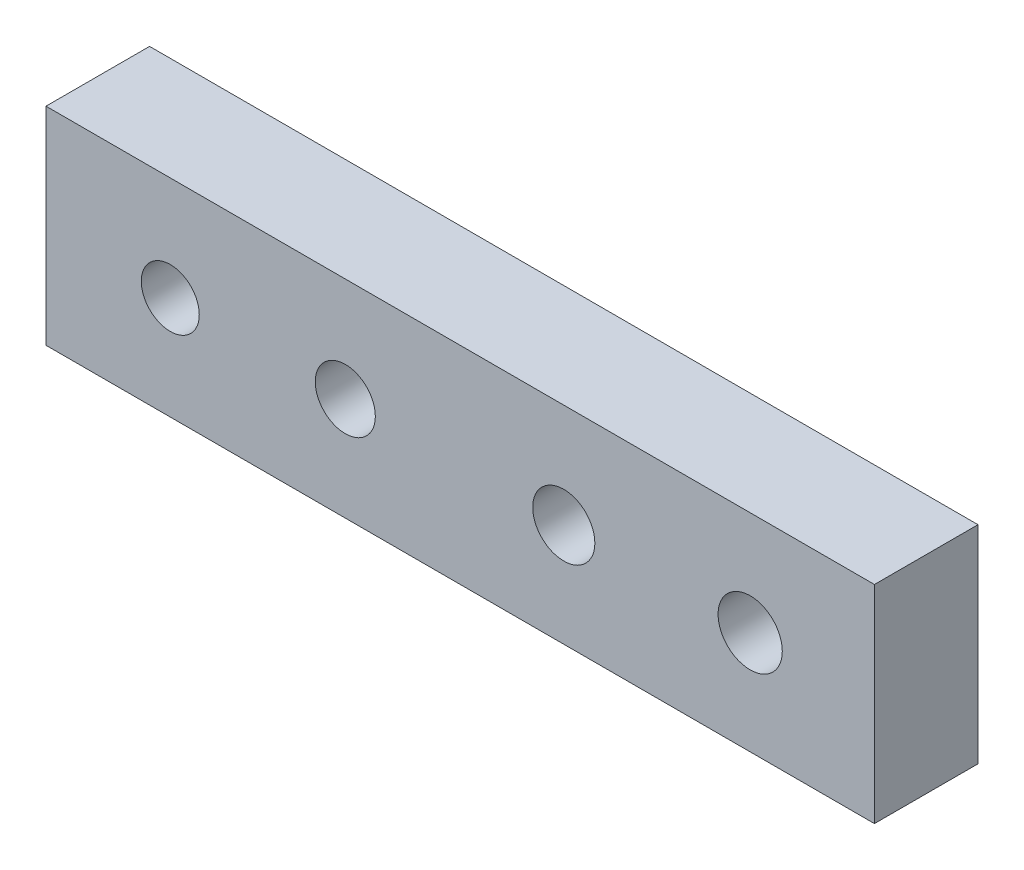
from build123d import *

# Parameters (mm, degrees)
SKETCH2_W           = 40
SKETCH2_H           = 10
BOSS_EXTRUDE1_DEPTH = 5
SKETCH3_R           = 1.4
SKETCH3_R_2         = 1.45
SKETCH3_R_3         = 1.5
SKETCH3_R_4         = 1.55
CUT_EXTRUDE1_DEPTH  = 5


with BuildPart() as part:
    # Sketch2 → Boss-Extrude1 (new body)
    with BuildSketch(Plane.XY):
        with Locations((20, -5)):
            Rectangle(SKETCH2_W, SKETCH2_H)
    extrude(amount=BOSS_EXTRUDE1_DEPTH)

    # Sketch3 → Cut-Extrude1 (cut)
    with BuildSketch(Plane.XY.offset(5)):
        with Locations((6, -5.020319492)):
            Circle(SKETCH3_R)
        with Locations((14.451243537, -5.020319492)):
            Circle(SKETCH3_R_2)
        with Locations((25, -5.020319492)):
            Circle(SKETCH3_R_3)
        with Locations((34, -5.020319492)):
            Circle(SKETCH3_R_4)
    extrude(amount=-CUT_EXTRUDE1_DEPTH, mode=Mode.SUBTRACT)


solid = part.part
